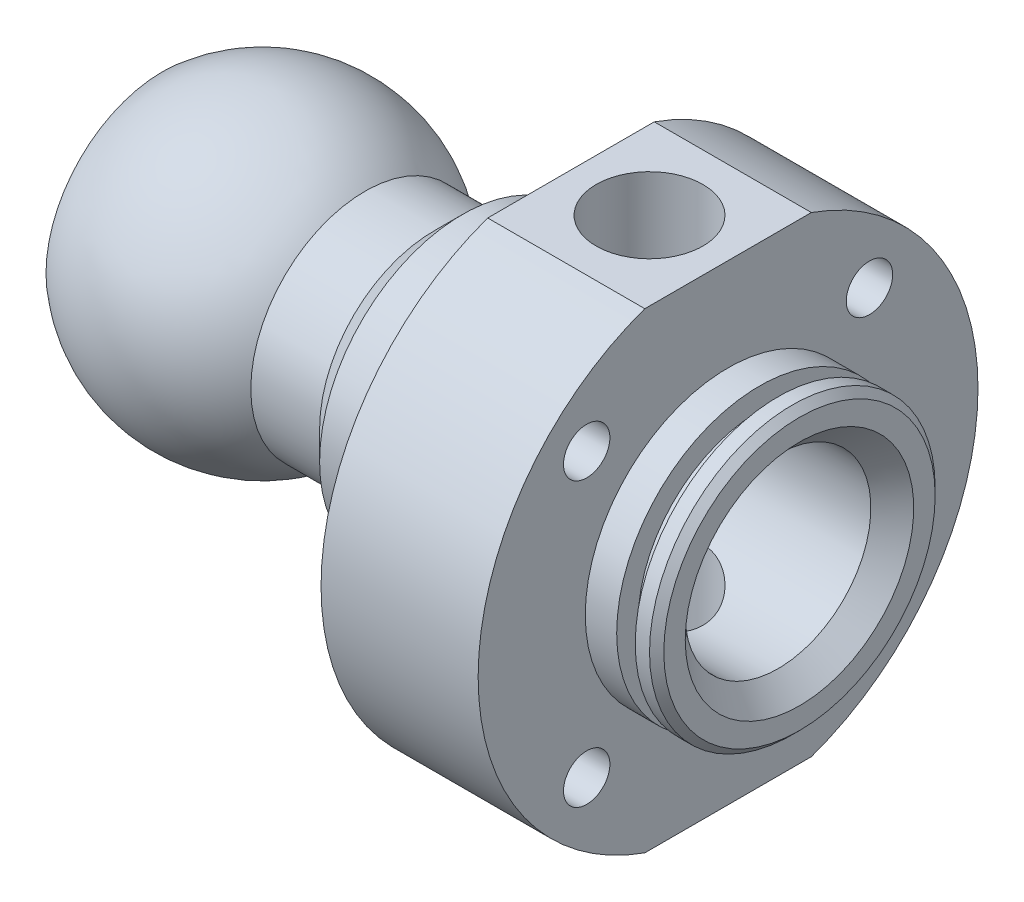
from build123d import *

# Parameters (mm, degrees)
ESQUISSE2_OUTSIDE_W          = 117.85
ESQUISSE2_OUTSIDE_H          = 98.65
ESQUISSE2_OUTSIDE_W_2        = 105
ESQUISSE2_OUTSIDE_H_2        = 66
ENL_V_MAT_EXTRU_1_DEPTH      = 50
ESQUISSE3_R                  = 7.475
ENL_V_MAT_EXTRU_2_DEPTH      = 90.95004169
ESQUISSE4_R                  = 3.25
ENL_V_MAT_EXTRU_3_DEPTH      = 93.664124701
R_P_TITION_CIRCULAIRE1_COUNT = 4
CHANFREIN1_SIZE              = 1


with BuildPart() as part:
    # Esquisse1 → Base-Révolution (revolve)
    with BuildSketch(Plane.XY, mode=Mode.PRIVATE) as base_r_volution_sk:
        with BuildLine():
            Line((39.1, 16), (39.1, 20))
            Line((39.1, 20), (36.1, 20))
            Line((36.1, 20), (36.1, 17))
            Line((36.1, 17), (33.5, 17))
            Line((33.5, 17), (33.5, 20))
            Line((33.5, 20), (29.1, 20))
            Line((29.1, 20), (29.1, 35))
            Line((29.1, 35), (7.1, 35))
            Line((7.1, 35), (7.1, 20))
            Line((7.1, 20), (-8.1, 20))
            Line((-8.1, 20), (-12.1, 16))
            Line((-12.1, 16), (-21.738593384, 16))
            ThreePointArc((-21.738593384, 16), (-35.859578061, 21.498655709), (-50.1, 16.317168872))
            Line((-50.1, 16.317168872), (-50.1, 10))
            Line((-50.1, 10), (-47.1, 10))
            Line((-47.1, 10), (-47.1, 13.25))
            Line((-47.1, 13.25), (-43.1, 13.25))
            Line((-43.1, 13.25), (-43.1, 10))
            Line((-43.1, 10), (-29, 10))
            Line((-29, 10), (-28.9, 10.1))
            Line((-28.9, 10.1), (8.2, 10.1))
            Line((8.2, 10.1), (11.1, 13))
            Line((11.1, 13), (36.1, 13))
            Line((36.1, 13), (39.1, 16))
        make_face()
    revolve(base_r_volution_sk.sketch.rotate(Axis((-69, 0, 0), (1, 0, 0)), 90), axis=Axis((-69, 0, 0), (1, 0, 0)))

    # Esquisse2 outside → Enlèv. mat.-Extru.1 (cut, symmetric)
    with BuildSketch(Plane.XY):
        with Locations((-5.5, 0)):
            Rectangle(ESQUISSE2_OUTSIDE_W, ESQUISSE2_OUTSIDE_H)
        with Locations((-7.5, 0)):
            Rectangle(ESQUISSE2_OUTSIDE_W_2, ESQUISSE2_OUTSIDE_H_2, mode=Mode.SUBTRACT)
    extrude(amount=ENL_V_MAT_EXTRU_1_DEPTH, both=True, mode=Mode.SUBTRACT)

    # Esquisse3 → Enlèv. mat.-Extru.2 (cut, through all)
    with BuildSketch(Plane(origin=(0, 33, 0), x_dir=(-1, 0, 0), z_dir=(0, 1, 0))):
        with Locations((-18.1, 0)):
            Circle(ESQUISSE3_R)
    extrude(amount=-ENL_V_MAT_EXTRU_2_DEPTH, mode=Mode.SUBTRACT)

    # Esquisse4 → Enlèv. mat.-Extru.3 (cut, through all)
    with BuildSketch(Plane(origin=(29.1, 0, 0), x_dir=(0, 0, -1), z_dir=(1, 0, 0))):
        with Locations((19.798989873, -19.798989873)):
            Circle(ESQUISSE4_R)
    enl_v_mat_extru_3 = extrude(amount=-ENL_V_MAT_EXTRU_3_DEPTH, mode=Mode.SUBTRACT)

    # Répétition circulaire1: Enlèv. mat.-Extru.3 ×4 about axis
    r_p_tition_circulaire1_axis = Axis((-69, 0, 0), (1, 0, 0))
    for i in range(1, R_P_TITION_CIRCULAIRE1_COUNT):
        add(enl_v_mat_extru_3.rotate(r_p_tition_circulaire1_axis, i * 360 / R_P_TITION_CIRCULAIRE1_COUNT), mode=Mode.SUBTRACT)

    # Chanfrein1
    chanfrein1_edges = [part.edges().sort_by_distance(p)[0] for p in [
        (39.1, 0, -20),
    ]]
    chamfer(chanfrein1_edges, length=CHANFREIN1_SIZE)


solid = part.part
